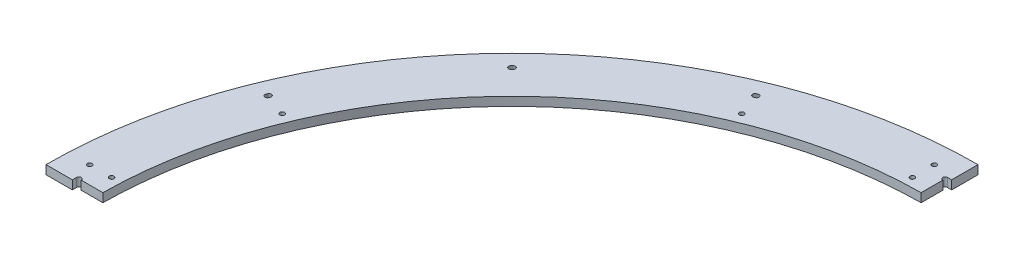
from build123d import *

# Parameters (mm, degrees)
BOSS_EXTRUDE1_DEPTH     = 12.7
SKETCH2_W               = 12.7
SKETCH2_H               = 38.133687951
SKETCH2_W_2             = 38.133687951
SKETCH2_H_2             = 12.7
CUT_EXTRUDE1_DEPTH      = 955.236729178
SKETCH3_R               = 3.429
CUT_EXTRUDE2_DEPTH      = 955.236729178
F_1_4_CLEARANCE_HOLE2_D = 6.7564
SKETCH8_W               = 674.6875
SKETCH8_H               = 674.6875
CUT_EXTRUDE4_DEPTH      = 955.236729178
SKETCH10_W              = 0.3175
SKETCH10_H              = 38.1
SKETCH10_W_2            = 38.1
SKETCH10_H_2            = 0.3175
CUT_EXTRUDE5_DEPTH      = 955.236729178
CUT_EXTRUDE6_DEPTH      = 955.236623537


with BuildPart() as part:
    # Sketch1 → Boss-Extrude1 (new body)
    with BuildSketch(Plane(origin=(0, 0, 0), x_dir=(1, 0, 0), z_dir=(0, 1, 0))):
        with BuildLine():
            Line((-598.4875, 0), (-674.6875, 0))
            ThreePointArc((-674.6875, 0), (0, 674.6875), (674.6875, 0))
            Line((674.6875, 0), (598.4875, 0))
            ThreePointArc((598.4875, 0), (0, 598.4875), (-598.4875, 0))
        make_face()
    extrude(amount=BOSS_EXTRUDE1_DEPTH)

    # Sketch2 → Cut-Extrude1 (cut, through all)
    with BuildSketch(Plane(origin=(0, 12.7, 0), x_dir=(1, 0, 0), z_dir=(0, 1, 0))):
        with Locations((0, 617.520656025)):
            Rectangle(SKETCH2_W, SKETCH2_H)
        with Locations((617.520656025, 0)):
            Rectangle(SKETCH2_W_2, SKETCH2_H_2)
        with Locations((0, -617.520656025)):
            Rectangle(SKETCH2_W, SKETCH2_H)
        with Locations((-617.520656025, 0)):
            Rectangle(SKETCH2_W_2, SKETCH2_H_2)
    extrude(amount=-CUT_EXTRUDE1_DEPTH, mode=Mode.SUBTRACT)

    # Sketch3 → Cut-Extrude2 (cut, through all)
    with BuildSketch(Plane(origin=(0, 12.7, 0), x_dir=(1, 0, 0), z_dir=(0, 1, 0))):
        with Locations((-6.35, 633.1585)):
            Circle(SKETCH3_R)
        with Locations((-633.1585, 6.35)):
            Circle(SKETCH3_R)
        with Locations((6.35, 633.1585)):
            Circle(SKETCH3_R)
        with Locations((633.1585, 6.35)):
            Circle(SKETCH3_R)
    extrude(amount=-CUT_EXTRUDE2_DEPTH, mode=Mode.SUBTRACT)

    # 1/4 Clearance Hole2 (through all)
    with Locations(Plane(origin=(0, 12.7, 0), x_dir=(1, 0, 0), z_dir=(0, 1, 0))):
        with Locations((-31.75, 642.9375), (-31.75, 611.1875), (-611.1875, 31.75), (-642.9375, 31.75), (-567.596939292, 235.106350216), (-235.106350216, 567.596939292)):
            Hole(F_1_4_CLEARANCE_HOLE2_D / 2)

    # Sketch8 → Cut-Extrude4 (cut, through all)
    with BuildSketch(Plane(origin=(0, 12.7, 0), x_dir=(1, 0, 0), z_dir=(0, 1, 0))):
        with Locations((337.34375, 337.34375)):
            Rectangle(SKETCH8_W, SKETCH8_H)
    extrude(amount=-CUT_EXTRUDE4_DEPTH, mode=Mode.SUBTRACT)

    # Sketch10 → Cut-Extrude5 (cut, through all)
    with BuildSketch(Plane(origin=(0, 12.7, 0), x_dir=(1, 0, 0), z_dir=(0, 1, 0))):
        with Locations((-0.15875, 655.6375)):
            Rectangle(SKETCH10_W, SKETCH10_H)
        with Locations((-655.6375, 0.15875)):
            Rectangle(SKETCH10_W_2, SKETCH10_H_2)
    extrude(amount=-CUT_EXTRUDE5_DEPTH, mode=Mode.SUBTRACT)

    # Sketch13 → Cut-Extrude6 (cut, through all)
    with BuildSketch(Plane(origin=(0, 12.7, 0), x_dir=(1, 0, 0), z_dir=(0, 1, 0))):
        with BuildLine():
            ThreePointArc((-602.990490798, 249.74984277), (-603.400029696, 248.75875888), (-603.807939635, 247.767003434))
            ThreePointArc((-603.807939635, 247.767003434), (-601.965070474, 243.359248479), (-597.55731552, 245.20211764))
            ThreePointArc((-597.55731552, 245.20211764), (-597.153628267, 246.183606427), (-596.748328919, 247.164430609))
            ThreePointArc((-596.748328919, 247.164430609), (-598.576703778, 251.578217629), (-602.990490798, 249.74984277))
        make_face()
        with BuildLine():
            ThreePointArc((-460.745442177, 462.261996567), (-461.504342318, 461.504342318), (-462.261996567, 460.745442177))
            ThreePointArc((-462.261996567, 460.745442177), (-462.254146876, 455.967952369), (-457.476657068, 455.97580206))
            ThreePointArc((-457.476657068, 455.97580206), (-456.726846061, 456.726846061), (-455.97580206, 457.476657068))
            ThreePointArc((-455.97580206, 457.476657068), (-455.967952369, 462.254146876), (-460.745442177, 462.261996567))
        make_face()
        with BuildLine():
            ThreePointArc((-247.767003434, 603.807939635), (-248.75875888, 603.400029696), (-249.74984277, 602.990490798))
            ThreePointArc((-249.74984277, 602.990490798), (-251.578217629, 598.576703778), (-247.164430609, 596.748328919))
            ThreePointArc((-247.164430609, 596.748328919), (-246.183606427, 597.153628267), (-245.20211764, 597.55731552))
            ThreePointArc((-245.20211764, 597.55731552), (-243.359248479, 601.965070474), (-247.767003434, 603.807939635))
        make_face()
    extrude(amount=-CUT_EXTRUDE6_DEPTH, mode=Mode.SUBTRACT)


solid = part.part
